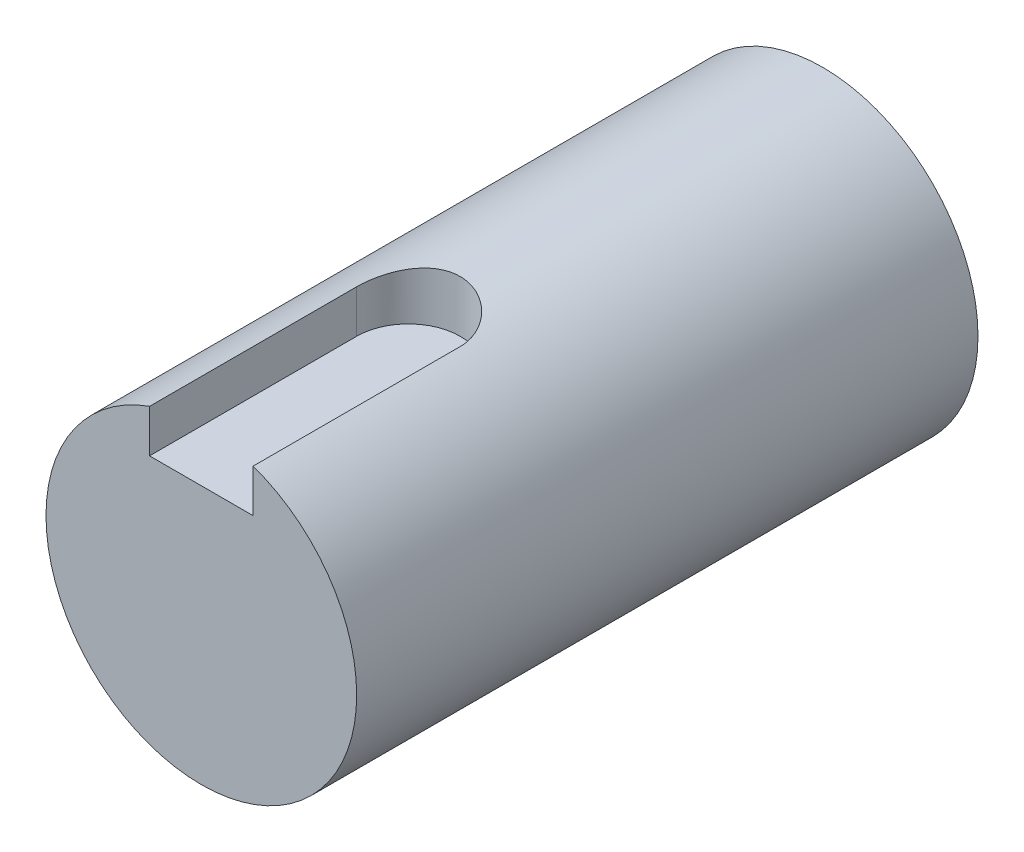
from build123d import *

# Parameters (mm, degrees)
SKETCH1_R           = 15
BOSS_EXTRUDE1_DEPTH = 30
CUT_EXTRUDE1_DEPTH  = 5


with BuildPart() as part:
    # Sketch1 → Boss-Extrude1 (new, symmetric)
    with BuildSketch(Plane.XY):
        Circle(SKETCH1_R)
    extrude(amount=BOSS_EXTRUDE1_DEPTH, both=True)

    # Sketch2 → Cut-Extrude1 (cut)
    with BuildSketch(Plane(origin=(0, 15, 0), x_dir=(1, 0, 0), z_dir=(0, 1, 0))):
        with BuildLine():
            Line((5, -10), (5, -30))
            ThreePointArc((5, -30), (0, -35), (-5, -30))
            Line((-5, -30), (-5, -10))
            ThreePointArc((-5, -10), (0, -5), (5, -10))
        make_face()
    extrude(amount=-CUT_EXTRUDE1_DEPTH, mode=Mode.SUBTRACT)


solid = part.part
